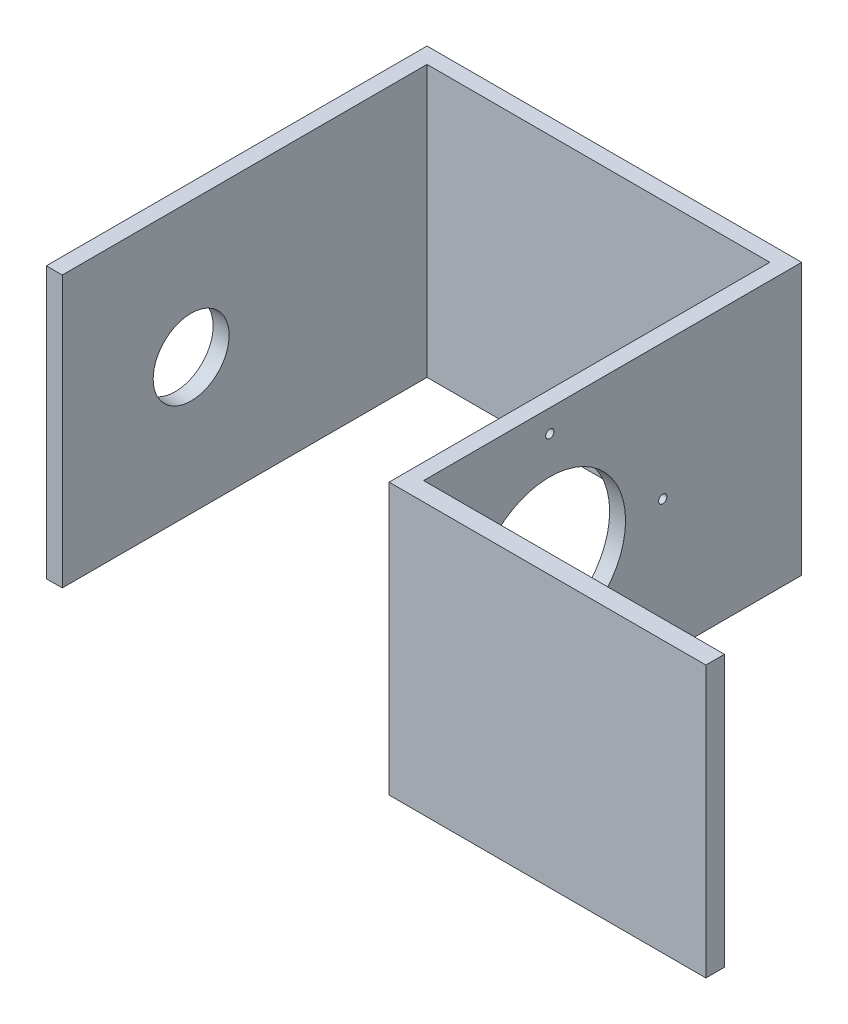
from build123d import *

# Parameters (mm, degrees)
BOSS_EXTRUDE3_DEPTH      = 51
BOSS_EXTRUDE3_DEPTH_BACK = 51
CUT_EXTRUDE3_REACH       = 179.381
SKETCH7_R                = 1.5635
SKETCH7_R_2              = 28.5
CUT_EXTRUDE4_REACH       = 278.066
SKETCH8_R                = 14.2875


with BuildPart() as part:
    # Sketch6 → Boss-Extrude3 (new, two sides: drawn at the far end of the back side and taken through both)
    with BuildSketch(Plane(origin=(0, 0, 0), x_dir=(1, 0, 0), z_dir=(0, 1, 0)).offset(-BOSS_EXTRUDE3_DEPTH_BACK)):
        Polygon((183.723, -47.5), (183.723, -54.5), (64.5, -54.5), (64.5, 88.773061806), (-64.5, 88.773061806), (-64.5, -48.5), (-70.5, -48.5), (-70.5, 94.773061806), (70.5, 94.773061806), (70.5, -47.5), align=None)
    extrude(amount=BOSS_EXTRUDE3_DEPTH + BOSS_EXTRUDE3_DEPTH_BACK)

    # Sketch7 → Cut-Extrude3 (cut, up to next)
    with BuildSketch(Plane(origin=(70.5, 0, 0), x_dir=(0, 0, -1), z_dir=(1, 0, 0)), mode=Mode.PRIVATE) as cut_extrude3_sk1:
        with Locations((0, 42.5)):
            Circle(SKETCH7_R)
    cut_extrude3_tool1 = extrude(cut_extrude3_sk1.sketch, amount=-CUT_EXTRUDE3_REACH, mode=Mode.PRIVATE) & part.part
    # Sketch7 → Cut-Extrude3 (cut, up to next)
    with BuildSketch(Plane(origin=(70.5, 0, 0), x_dir=(0, 0, -1), z_dir=(1, 0, 0)), mode=Mode.PRIVATE) as cut_extrude3_sk2:
        with Locations((42.5, 0)):
            Circle(SKETCH7_R)
    cut_extrude3_tool2 = extrude(cut_extrude3_sk2.sketch, amount=-CUT_EXTRUDE3_REACH, mode=Mode.PRIVATE) & part.part
    # Sketch7 → Cut-Extrude3 (cut, up to next)
    with BuildSketch(Plane(origin=(70.5, 0, 0), x_dir=(0, 0, -1), z_dir=(1, 0, 0)), mode=Mode.PRIVATE) as cut_extrude3_sk3:
        with Locations((0, -42.5)):
            Circle(SKETCH7_R)
    cut_extrude3_tool3 = extrude(cut_extrude3_sk3.sketch, amount=-CUT_EXTRUDE3_REACH, mode=Mode.PRIVATE) & part.part
    # Sketch7 → Cut-Extrude3 (cut, up to next)
    with BuildSketch(Plane(origin=(70.5, 0, 0), x_dir=(0, 0, -1), z_dir=(1, 0, 0)), mode=Mode.PRIVATE) as cut_extrude3_sk4:
        with Locations((-42.5, 0)):
            Circle(SKETCH7_R)
    cut_extrude3_tool4 = extrude(cut_extrude3_sk4.sketch, amount=-CUT_EXTRUDE3_REACH, mode=Mode.PRIVATE) & part.part
    # Sketch7 → Cut-Extrude3 (cut, up to next)
    with BuildSketch(Plane(origin=(70.5, 0, 0), x_dir=(0, 0, -1), z_dir=(1, 0, 0)), mode=Mode.PRIVATE) as cut_extrude3_sk5:
        Circle(SKETCH7_R_2)
    cut_extrude3_tool5 = extrude(cut_extrude3_sk5.sketch, amount=-CUT_EXTRUDE3_REACH, mode=Mode.PRIVATE) & part.part
    add(cut_extrude3_tool1.solids().sort_by_distance((70.5, 42.5, 0))[0], mode=Mode.SUBTRACT)
    add(cut_extrude3_tool2.solids().sort_by_distance((70.5, 0, -42.5))[0], mode=Mode.SUBTRACT)
    add(cut_extrude3_tool3.solids().sort_by_distance((70.5, -42.5, 0))[0], mode=Mode.SUBTRACT)
    add(cut_extrude3_tool4.solids().sort_by_distance((70.5, 0, 42.5))[0], mode=Mode.SUBTRACT)
    add(cut_extrude3_tool5.solids().sort_by_distance((70.5, 0, 0))[0], mode=Mode.SUBTRACT)

    # Sketch8 → Cut-Extrude4 (cut, up to next)
    with BuildSketch(Plane.ZY.offset(70.5), mode=Mode.PRIVATE) as cut_extrude4_sk1:
        Circle(SKETCH8_R)
    cut_extrude4_tool1 = extrude(cut_extrude4_sk1.sketch, amount=-CUT_EXTRUDE4_REACH, mode=Mode.PRIVATE) & part.part
    add(cut_extrude4_tool1.solids().sort_by_distance((-70.5, 0, 0))[0], mode=Mode.SUBTRACT)


solid = part.part
